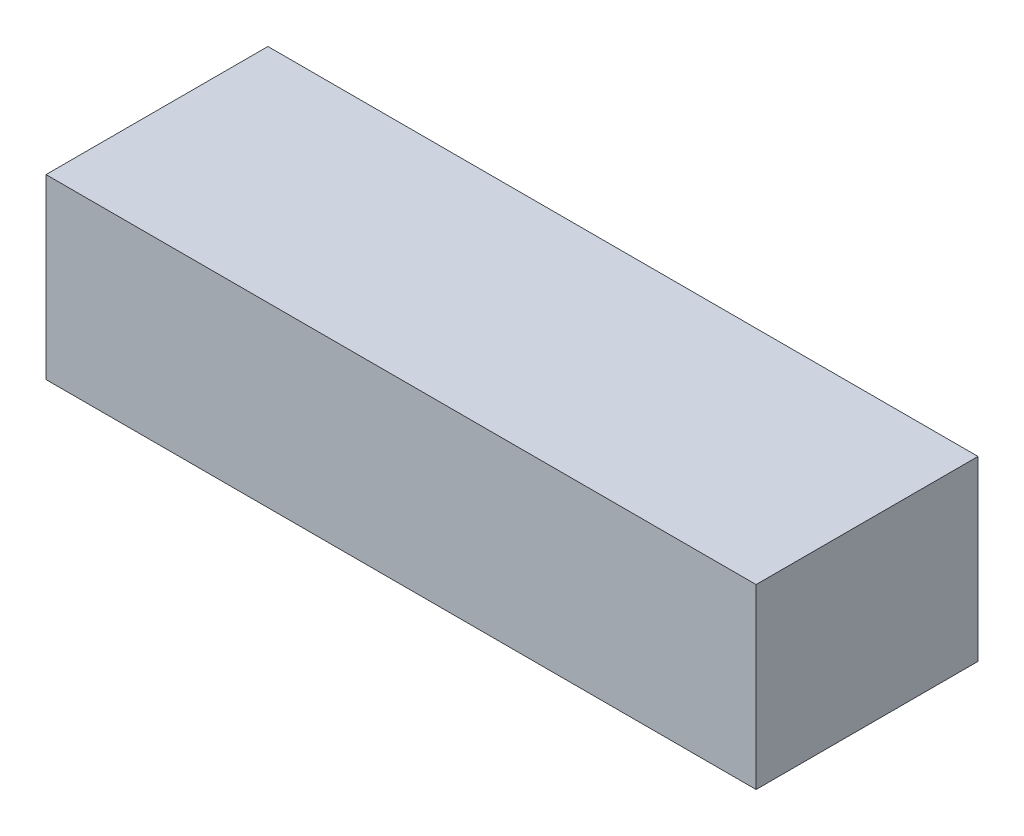
from build123d import *

# Parameters (mm, degrees)
SKETCH1_W           = 40.64
SKETCH1_H           = 12.7
BOSS_EXTRUDE1_DEPTH = 10.16


with BuildPart() as part:
    # Sketch1 → Boss-Extrude1 (new body)
    with BuildSketch(Plane(origin=(0, 0, 0), x_dir=(1, 0, 0), z_dir=(0, 1, 0))):
        with Locations((20.32, 6.35)):
            Rectangle(SKETCH1_W, SKETCH1_H)
    extrude(amount=BOSS_EXTRUDE1_DEPTH)


solid = part.part
